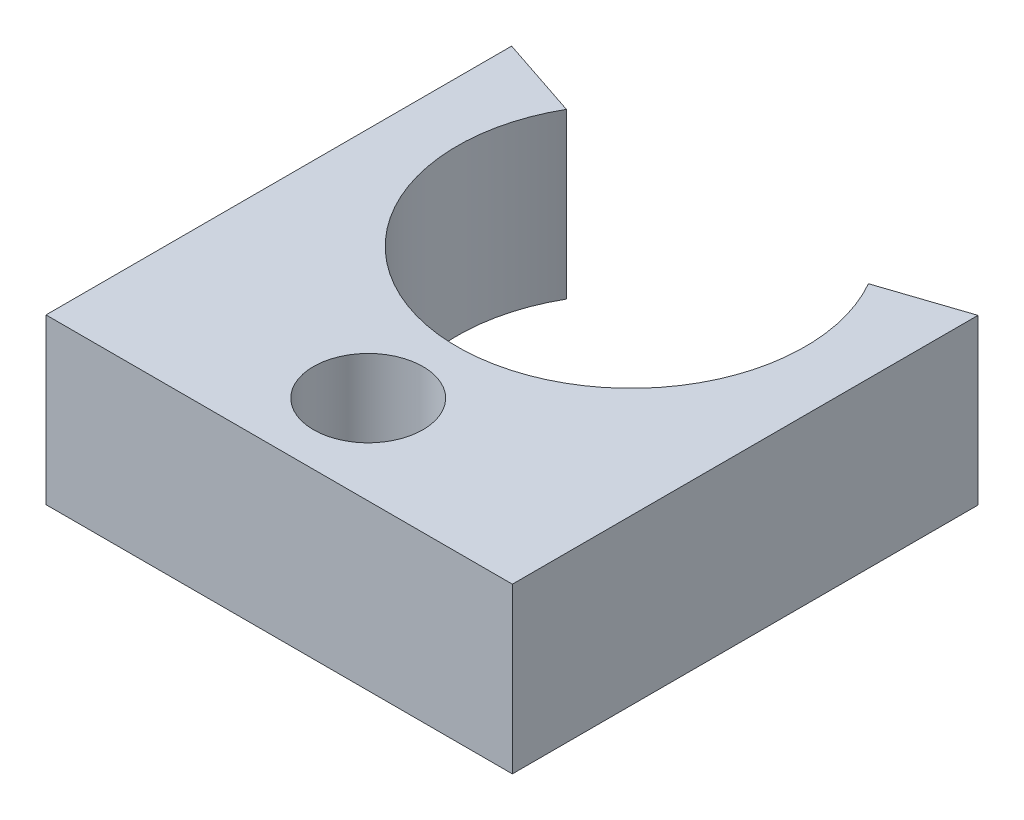
from build123d import *

# Parameters (mm, degrees)
SKETCH1_R           = 4
BOSS_EXTRUDE1_DEPTH = 12


with BuildPart() as part:
    # Sketch1 → Boss-Extrude1 (new body)
    with BuildSketch(Plane(origin=(0, 0, 0), x_dir=(1, 0, 0), z_dir=(0, 1, 0))):
        with BuildLine():
            Line((-34.054478003, 34), (-34.054478003, 0))
            Line((-34.054478003, 0), (0, 0))
            Line((0, 0), (0, 34))
            Line((0, 34), (-6, 32))
            ThreePointArc((-6, 32), (-17.027239002, 13), (-28.054478003, 32))
            Line((-28.054478003, 32), (-34.054478003, 34))
        make_face()
        with Locations(Location((-17.027239002, 6.5, 0), (0, 0, 270))):
            Circle(SKETCH1_R, mode=Mode.SUBTRACT)
    extrude(amount=BOSS_EXTRUDE1_DEPTH)


solid = part.part
